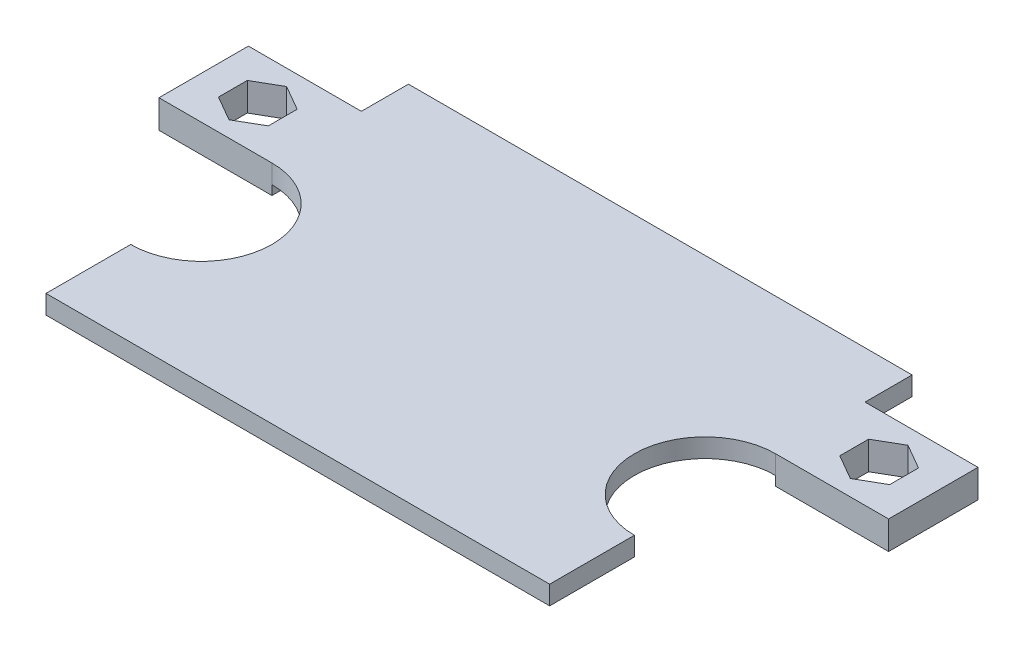
from build123d import *

# Parameters (mm, degrees)
SKETCH1_W           = 53.5
SKETCH1_H           = 38.5
BOSS_EXTRUDE1_DEPTH = 2
SKETCH2_W           = 12
SKETCH2_H           = 9.5
BOSS_EXTRUDE2_DEPTH = 3
CUT_EXTRUDE1_DEPTH  = 2


with BuildPart() as part:
    # Sketch1 → Boss-Extrude1 (new body)
    with BuildSketch(Plane(origin=(0, 0, 0), x_dir=(1, 0, 0), z_dir=(0, 1, 0))):
        Rectangle(SKETCH1_W, SKETCH1_H)
    extrude(amount=-BOSS_EXTRUDE1_DEPTH)

    # Sketch2 → Boss-Extrude2 (add)
    # profile 1 of 2: a face of its own
    with BuildSketch(Plane(origin=(0, 0, 0), x_dir=(1, 0, 0), z_dir=(0, 1, 0))):
        with Locations((-32.75, 9.5)):
            Rectangle(SKETCH2_W, SKETCH2_H)
        Polygon((-33, 6.440043573), (-30.35, 7.970021787), (-30.35, 11.029978213), (-33, 12.559956427), (-35.65, 11.029978213), (-35.65, 7.970021787), align=None, mode=Mode.SUBTRACT)
    # profile 2 of 2: a face of its own
    with BuildSketch(Plane(origin=(0, 0, 0), x_dir=(1, 0, 0), z_dir=(0, 1, 0))):
        with Locations((32.75, 9.5)):
            Rectangle(SKETCH2_W, SKETCH2_H)
        Polygon((35.65, 7.970021787), (33, 6.440043573), (30.35, 7.970021787), (30.35, 11.029978213), (33, 12.559956427), (35.65, 11.029978213), align=None, mode=Mode.SUBTRACT)
    extrude(amount=-BOSS_EXTRUDE2_DEPTH)

    # Sketch3 → Cut-Extrude1 (cut)
    with BuildSketch(Plane(origin=(0, 0, 0), x_dir=(1, 0, 0), z_dir=(0, 1, 0))):
        with BuildLine():
            Line((-26.75, 4.75), (-26.75, -10.25))
            ThreePointArc((-26.75, -10.25), (-19.25, -2.75), (-26.75, 4.75))
        make_face()
        with BuildLine():
            Line((26.75, 4.75), (26.75, -10.25))
            ThreePointArc((26.75, -10.25), (19.25, -2.75), (26.75, 4.75))
        make_face()
    extrude(amount=-CUT_EXTRUDE1_DEPTH, mode=Mode.SUBTRACT)


solid = part.part
